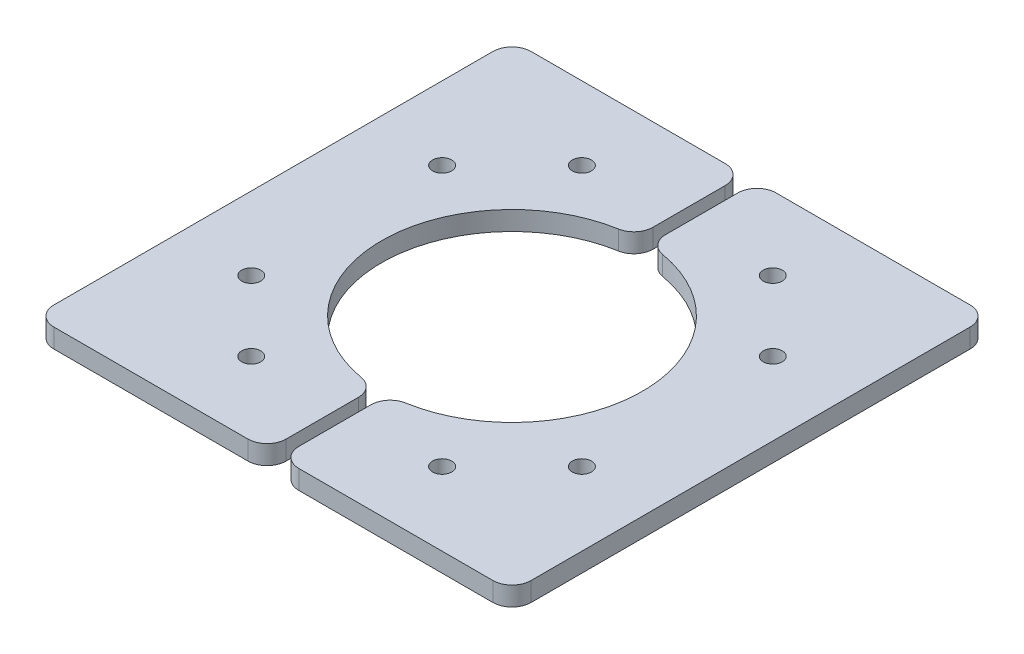
from build123d import *

# Parameters (mm, degrees)
SKETCH2_R            = 20.5
BOSS_EXTRUDE1_DEPTH  = 3
HALFSPLIT_DEPTH      = 54.117793629
HALFSPLIT_DEPTH_BACK = 54.117793629
SKETCH3_W            = 2
SKETCH3_H            = 75
SKETCH4_R            = 1.5
HOLES_DEPTH          = 54.117793629
FILLET1_R            = 3
FILLET2_R            = 3


with BuildPart() as part:
    # Sketch2 → Boss-Extrude1 (new body)
    with BuildSketch(Plane(origin=(0, 0, 0), x_dir=(1, 0, 0), z_dir=(0, 1, 0))):
        Polygon((-37.5, -37.5), (0, -37.5), (37.5, -37.5), (37.5, 37.5), (-37.5, 37.5), align=None)
        Circle(SKETCH2_R, mode=Mode.SUBTRACT)
    extrude(amount=BOSS_EXTRUDE1_DEPTH)

    # Sketch3 → HalfSplit (cut, two sides: drawn at the far end of the back side and taken through both)
    with BuildSketch(Plane(origin=(0, 0, 0), x_dir=(1, 0, 0), z_dir=(0, 1, 0)).offset(-HALFSPLIT_DEPTH_BACK)):
        Rectangle(SKETCH3_W, SKETCH3_H)
    extrude(amount=HALFSPLIT_DEPTH + HALFSPLIT_DEPTH_BACK, mode=Mode.SUBTRACT)


with BuildPart() as halfsplit_piece_1:
    # of the separate pieces the step leaves, piece 1, a body of its own (halfsplit_pieces)
    add(part.part.solids().sort_by_distance((-37.5, 0, 37.5))[0])

    # Fillet2
    fillet2_edges = [halfsplit_piece_1.edges().sort_by_distance(p)[0] for p in [
        (-37.5, 1.5, 37.5),
        (-37.5, 1.5, -37.5),
        (-1, 1.5, -20.475595229),
        (-1, 1.5, 20.475595229),
        (-1, 1.5, 37.5),
        (-1, 1.5, -37.5),
    ]]
    fillet(fillet2_edges, radius=FILLET2_R)


with BuildPart() as halfsplit_piece_2:
    # of the separate pieces the step leaves, piece 2, a body of its own (halfsplit_pieces)
    add(part.part.solids().sort_by_distance((1, 0, 37.5))[0])

    # Sketch4 → Holes (cut, through all)
    with BuildSketch(Plane(origin=(0, 0, 0), x_dir=(1, 0, 0), z_dir=(0, 1, 0))):
        with Locations((25.980762114, -15)):
            Circle(SKETCH4_R)
        with Locations((25.980762114, 15)):
            Circle(SKETCH4_R)
        with Locations((15, -25.980762114)):
            Circle(SKETCH4_R)
        with Locations((15, 25.980762114)):
            Circle(SKETCH4_R)
    holes = extrude(amount=HOLES_DEPTH, mode=Mode.SUBTRACT)

    # Fillet1
    fillet1_edges = [halfsplit_piece_2.edges().sort_by_distance(p)[0] for p in [
        (37.5, 1.5, 37.5),
        (1, 1.5, 37.5),
        (1, 1.5, 20.475595229),
        (1, 1.5, -20.475595229),
        (1, 1.5, -37.5),
        (37.5, 1.5, -37.5),
    ]]
    fillet(fillet1_edges, radius=FILLET1_R)


with BuildPart() as halfsplit_piece_1_1:
    add(halfsplit_piece_1.part)

    # Mirror-Holes: Holes across plane
    add(holes.mirror(Plane(origin=(0, 0, 0), x_dir=(0, 0, 1), z_dir=(1, 0, 0))), mode=Mode.SUBTRACT)


solid = Compound([halfsplit_piece_2.part, halfsplit_piece_1_1.part])
